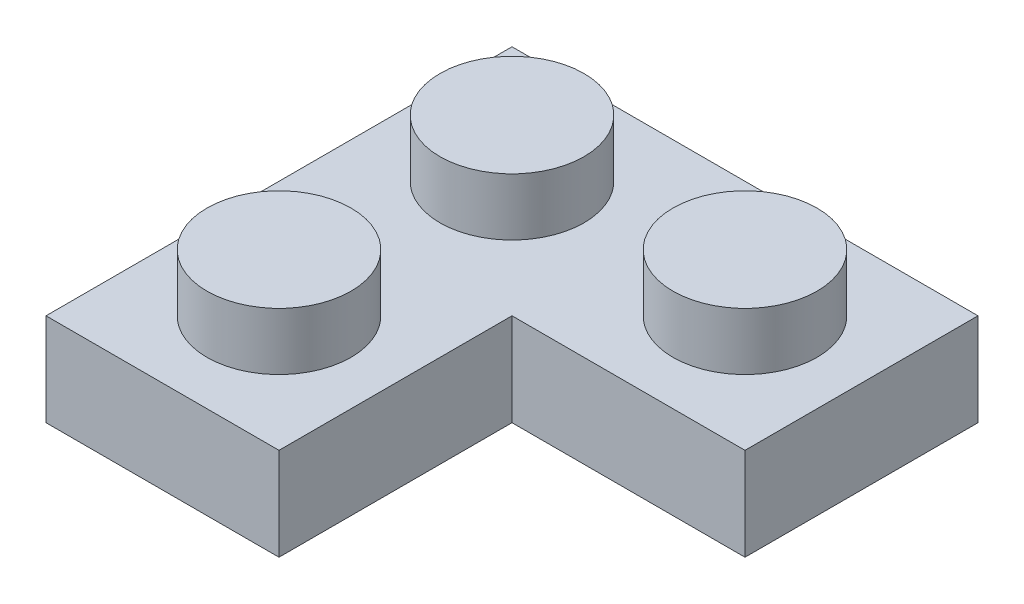
from build123d import *

# Parameters (mm, degrees)
BOSS_EXTRUDE1_DEPTH = 3.15
SKETCH3_R           = 2.45
BOSS_EXTRUDE2_DEPTH = 1.95
SHELL1_T            = -1.5


with BuildPart() as part:
    # Sketch2 → Boss-Extrude1 (new body)
    with BuildSketch(Plane(origin=(0, 0, 0), x_dir=(1, 0, 0), z_dir=(0, 1, 0))):
        Polygon((0, 0), (0, -7.925), (-7.925, -7.925), (-7.925, 7.925), (7.925, 7.925), (7.925, 0), align=None)
    extrude(amount=-BOSS_EXTRUDE1_DEPTH)

    # Sketch3 → Boss-Extrude2 (add)
    with BuildSketch(Plane(origin=(0, 0, 0), x_dir=(1, 0, 0), z_dir=(0, 1, 0))):
        with Locations(Location((-3.9625, 3.9625, 0), (0, 0, 270))):
            Circle(SKETCH3_R)
        with Locations(Location((3.9625, 3.9625, 0), (0, 0, 270))):
            Circle(SKETCH3_R)
        with Locations(Location((-3.9625, -3.9625, 0), (0, 0, 270))):
            Circle(SKETCH3_R)
    extrude(amount=BOSS_EXTRUDE2_DEPTH)

    # Shell1
    shell1_openings = [part.faces().sort_by_distance(p)[0] for p in [
        (-1.320833333, -3.15, -1.320833333),
    ]]
    offset(amount=SHELL1_T, openings=shell1_openings, kind=Kind.INTERSECTION)


solid = part.part
